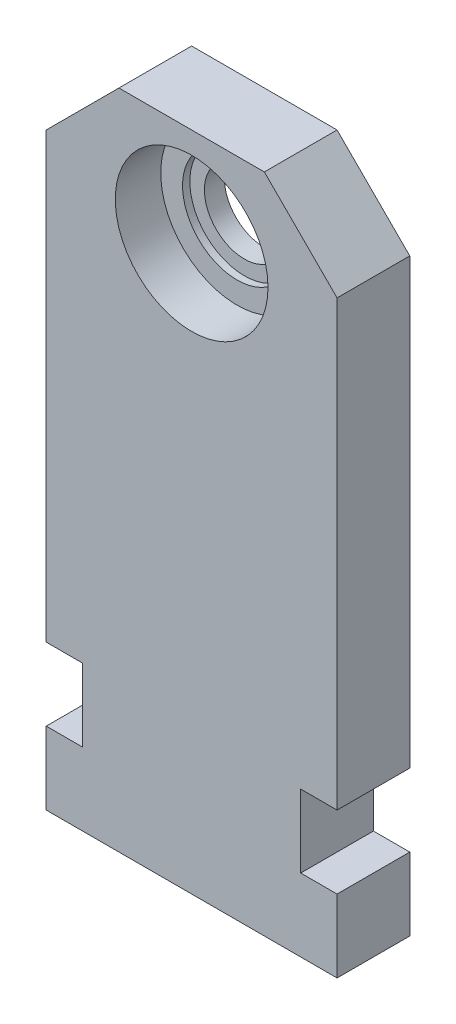
from build123d import *

# Parameters (mm, degrees)
ESQUISSE1_W                  = 80
ESQUISSE1_H                  = 182
BOSS_EXTRU_1_DEPTH           = 20
ENL_V_MAT_EXTRU_1_DEPTH      = 200.809909664
ENL_V_MAT_EXTRU_1_DEPTH_BACK = 200.809909664
ESQUISSE2_R                  = 11
CHANFREIN1_SIZE              = 20
ESQUISSE3_R                  = 21
ENL_V_MAT_EXTRU_2_DEPTH      = 12.5
ESQUISSE4_R                  = 15
ENL_V_MAT_EXTRU_3_DEPTH      = 2
ENL_V_MAT_EXTRU_4_DEPTH      = 200.809909664
ENL_V_MAT_EXTRU_4_DEPTH_BACK = 200.809909664
ESQUISSE5_W                  = 10
ESQUISSE5_H                  = 20


with BuildPart() as part:
    # Esquisse1 → Boss.-Extru.1 (new body)
    with BuildSketch(Plane.XY):
        with Locations((40, 91)):
            Rectangle(ESQUISSE1_W, ESQUISSE1_H)
    extrude(amount=BOSS_EXTRU_1_DEPTH)

    # Esquisse2 → Enlèv. mat.-Extru.1 (cut, two sides: drawn at the far end of the back side and taken through both)
    with BuildSketch(Plane.XY.offset(20).offset(-ENL_V_MAT_EXTRU_1_DEPTH_BACK)):
        with Locations((40, 155)):
            Circle(ESQUISSE2_R)
    extrude(amount=ENL_V_MAT_EXTRU_1_DEPTH + ENL_V_MAT_EXTRU_1_DEPTH_BACK, mode=Mode.SUBTRACT)

    # Chanfrein1
    chanfrein1_edges = [part.edges().sort_by_distance(p)[0] for p in [
        (0, 182, 10),
        (80, 182, 10),
    ]]
    chamfer(chanfrein1_edges, length=CHANFREIN1_SIZE)

    # Esquisse3 → Enlèv. mat.-Extru.2 (cut)
    with BuildSketch(Plane.XY.offset(20)):
        with Locations((40, 155)):
            Circle(ESQUISSE3_R)
    extrude(amount=-ENL_V_MAT_EXTRU_2_DEPTH, mode=Mode.SUBTRACT)

    # Esquisse4 → Enlèv. mat.-Extru.3 (cut)
    with BuildSketch(Plane.XY.offset(7.5)):
        with Locations((40, 155)):
            Circle(ESQUISSE4_R)
    extrude(amount=-ENL_V_MAT_EXTRU_3_DEPTH, mode=Mode.SUBTRACT)

    # Esquisse5 → Enlèv. mat.-Extru.4 (cut, two sides: drawn at the far end of the back side and taken through both)
    with BuildSketch(Plane.XY.offset(20).offset(-ENL_V_MAT_EXTRU_4_DEPTH_BACK)):
        with Locations((75, 30)):
            Rectangle(ESQUISSE5_W, ESQUISSE5_H)
        with Locations((5, 30)):
            Rectangle(ESQUISSE5_W, ESQUISSE5_H)
    extrude(amount=ENL_V_MAT_EXTRU_4_DEPTH + ENL_V_MAT_EXTRU_4_DEPTH_BACK, mode=Mode.SUBTRACT)


solid = part.part
